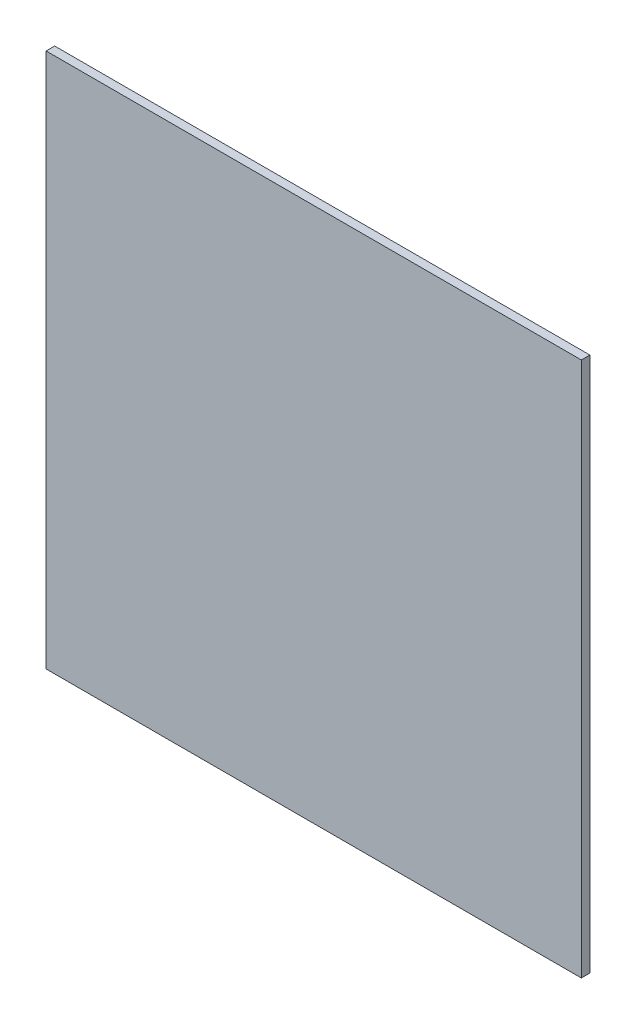
from build123d import *

# Parameters (mm, degrees)
SKETCH1_W           = 100
SKETCH1_H           = 100
BOSS_EXTRUDE1_DEPTH = 1.6


with BuildPart() as part:
    # Sketch1 → Boss-Extrude1 (new body)
    with BuildSketch(Plane.XY):
        with Locations((50, -50)):
            Rectangle(SKETCH1_W, SKETCH1_H)
    extrude(amount=BOSS_EXTRUDE1_DEPTH)


solid = part.part
